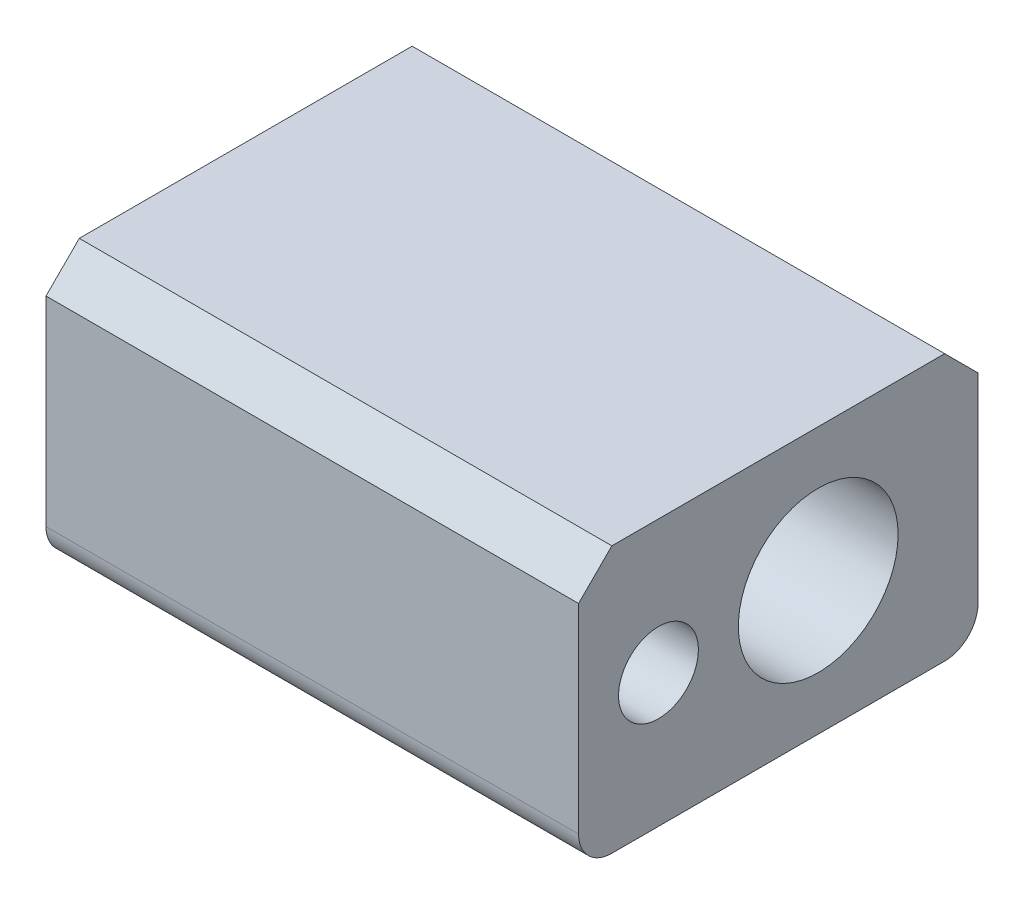
from build123d import *

# Parameters (mm, degrees)
SKETCH1_W           = 50.8
SKETCH1_H           = 76.2
SKETCH1_R           = 15.24
SKETCH1_R_2         = 7.62
BOSS_EXTRUDE1_DEPTH = 101.6
FILLET1_R           = 6.35
CHAMFER1_SIZE       = 6.35


with BuildPart() as part:
    # Sketch1 → Boss-Extrude1 (new body)
    with BuildSketch(Plane.YZ):
        Rectangle(SKETCH1_W, SKETCH1_H)
        with Locations(Location((0, -7.62, 0), (0, 0, 270))):
            Circle(SKETCH1_R, mode=Mode.SUBTRACT)
        with Locations(Location((0, 22.86, 0), (0, 0, 270))):
            Circle(SKETCH1_R_2, mode=Mode.SUBTRACT)
    extrude(amount=BOSS_EXTRUDE1_DEPTH)

    # Fillet1
    fillet1_edges = [part.edges().sort_by_distance(p)[0] for p in [
        (50.8, -25.4, 38.1),
        (50.8, -25.4, -38.1),
    ]]
    fillet(fillet1_edges, radius=FILLET1_R)

    # Chamfer1
    chamfer1_edges = [part.edges().sort_by_distance(p)[0] for p in [
        (50.8, 25.4, 38.1),
        (50.8, 25.4, -38.1),
    ]]
    chamfer(chamfer1_edges, length=CHAMFER1_SIZE)


solid = part.part
